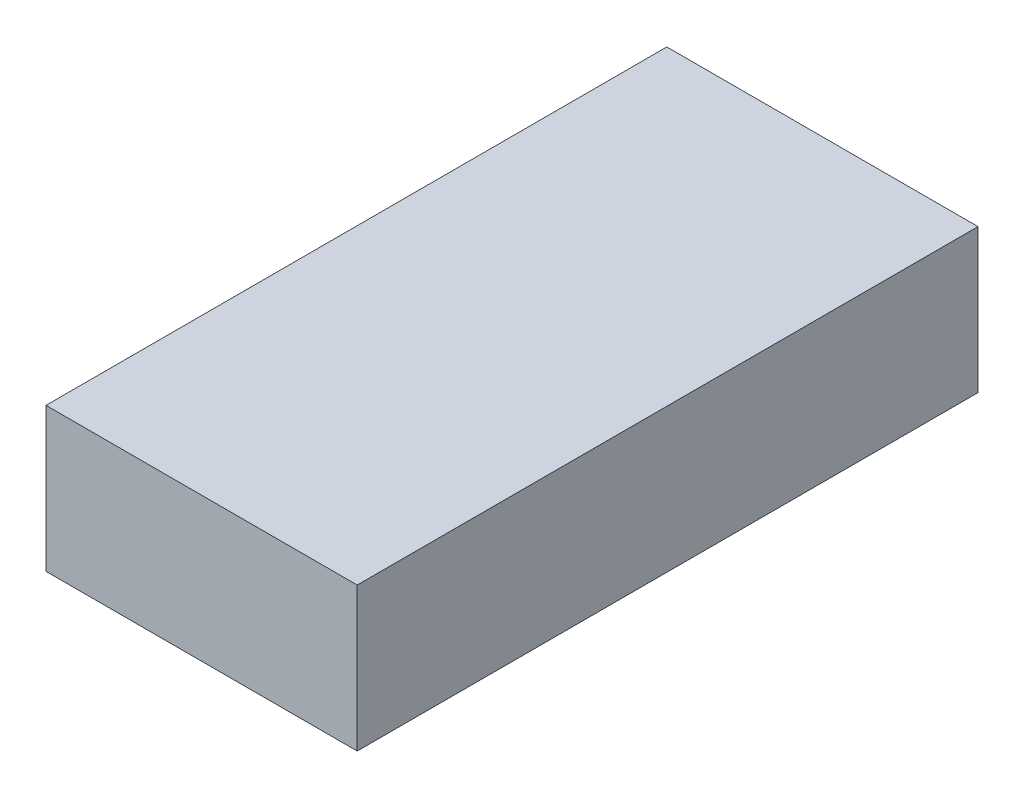
from build123d import *

# Parameters (mm, degrees)
SKETCH_1_W      = 150.385517242
SKETCH_1_H      = 69.485057472
EXTRUDE_1_DEPTH = 300


with BuildPart() as part:
    # 草图1 → 凸台-拉伸1 (new body)
    with BuildSketch(Plane.XY):
        Rectangle(SKETCH_1_W, SKETCH_1_H)
    extrude(amount=EXTRUDE_1_DEPTH)


solid = part.part
